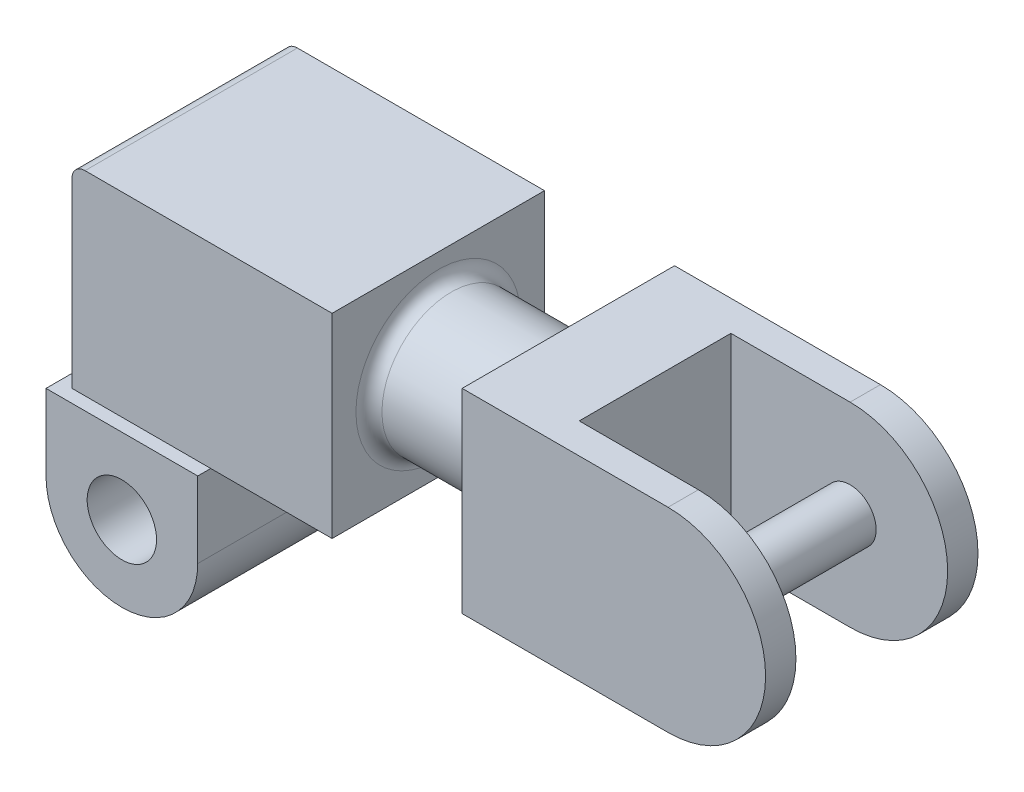
from build123d import *

# Parameters (mm, degrees)
IZIM1_R                     = 8
Y_KSEKLIK_EKSTR_ZYON1_DEPTH = 27.5
IZIM3_W                     = 60
IZIM3_H                     = 49
Y_KSEKLIK_EKSTR_ZYON2_DEPTH = 45
IZIM4_R                     = 16
Y_KSEKLIK_EKSTR_ZYON3_DEPTH = 30
Y_KSEKLIK_EKSTR_ZYON4_DEPTH = 45
RADYUS1_RADIUS              = 22.5
RADYUS1_LENGTH              = 7
RADYUS2_RADIUS              = 22.5
RADYUS2_LENGTH              = 7
RADYUS3_R                   = 3
IZIM8_R                     = 6
Y_KSEKLIK_EKSTR_ZYON5_DEPTH = 35


with BuildPart() as part:
    # Çizim1 → Yükseklik-Ekstrüzyon1 (new, symmetric)
    with BuildSketch(Plane.XY):
        with BuildLine():
            Line((-17.5, 0), (-17.5, 17.5))
            Line((-17.5, 17.5), (17.5, 17.5))
            Line((17.5, 17.5), (17.5, 0))
            ThreePointArc((17.5, 0), (0, -17.5), (-17.5, 0))
        make_face()
        Circle(IZIM1_R, mode=Mode.SUBTRACT)
    extrude(amount=Y_KSEKLIK_EKSTR_ZYON1_DEPTH, both=True)

    # Çizim3 → Yükseklik-Ekstrüzyon2 (add)
    with BuildSketch(Plane(origin=(0, 17.5, 0), x_dir=(1, 0, 0), z_dir=(0, 1, 0))):
        with Locations((15.5, 0)):
            Rectangle(IZIM3_W, IZIM3_H)
    extrude(amount=Y_KSEKLIK_EKSTR_ZYON2_DEPTH)

    # Çizim4 → Yükseklik-Ekstrüzyon3 (add)
    with BuildSketch(Plane(origin=(45.5, 0, 0), x_dir=(0, 0, -1), z_dir=(1, 0, 0))):
        with Locations((0, 40)):
            Circle(IZIM4_R)
    extrude(amount=Y_KSEKLIK_EKSTR_ZYON3_DEPTH)

    # Çizim7 → Yükseklik-Ekstrüzyon4 (add)
    with BuildSketch(Plane(origin=(0, 62.5, 0), x_dir=(1, 0, 0), z_dir=(0, 1, 0))):
        Polygon((75.5, -24.5), (75.5, 24.5), (145.5, 24.5), (145.5, 17.5), (95.5, 17.5), (95.5, -17.5), (145.5, -17.5), (145.5, -24.5), align=None)
    extrude(amount=-Y_KSEKLIK_EKSTR_ZYON4_DEPTH)

    # Radyus1: full round fillet: the end face becomes a half cylinder, R = half its width
    radyus1_face = Plane((145.5, 40, 21), x_dir=(0, 0, -1), z_dir=(1, 0, 0))  # on the end face: x along it, z out of the body
    radyus1_slab = radyus1_face.offset(-RADYUS1_RADIUS / 2) * Box(RADYUS1_LENGTH, 2 * RADYUS1_RADIUS, RADYUS1_RADIUS, mode=Mode.PRIVATE)  # the body's end, R deep
    radyus1_round = Plane((123, 40, 21), x_dir=(1, 0, 0), z_dir=(0, 0, -1)) * Cylinder(RADYUS1_RADIUS, RADYUS1_LENGTH, mode=Mode.PRIVATE)  # its axis R under the face
    add(radyus1_slab - radyus1_round, mode=Mode.SUBTRACT)

    # Radyus2: full round fillet: the end face becomes a half cylinder, R = half its width
    radyus2_face = Plane((145.5, 40, -21), x_dir=(0, 0, -1), z_dir=(1, 0, 0))  # on the end face: x along it, z out of the body
    radyus2_slab = radyus2_face.offset(-RADYUS2_RADIUS / 2) * Box(RADYUS2_LENGTH, 2 * RADYUS2_RADIUS, RADYUS2_RADIUS, mode=Mode.PRIVATE)  # the body's end, R deep
    radyus2_round = Plane((123, 40, -21), x_dir=(1, 0, 0), z_dir=(0, 0, -1)) * Cylinder(RADYUS2_RADIUS, RADYUS2_LENGTH, mode=Mode.PRIVATE)  # its axis R under the face
    add(radyus2_slab - radyus2_round, mode=Mode.SUBTRACT)

    # Radyus3
    radyus3_edges = [part.edges().sort_by_distance(p)[0] for p in [
        (-14.5, 62.5, 0),
        (45.5, 40, 16),
        (75.5, 40, 16),
    ]]
    fillet(radyus3_edges, radius=RADYUS3_R)

    # Çizim8 → Yükseklik-Ekstrüzyon5 (add)
    with BuildSketch(Plane.XY.offset(-17.5)):
        with Locations((123, 40)):
            Circle(IZIM8_R)
    extrude(amount=Y_KSEKLIK_EKSTR_ZYON5_DEPTH)


solid = part.part
